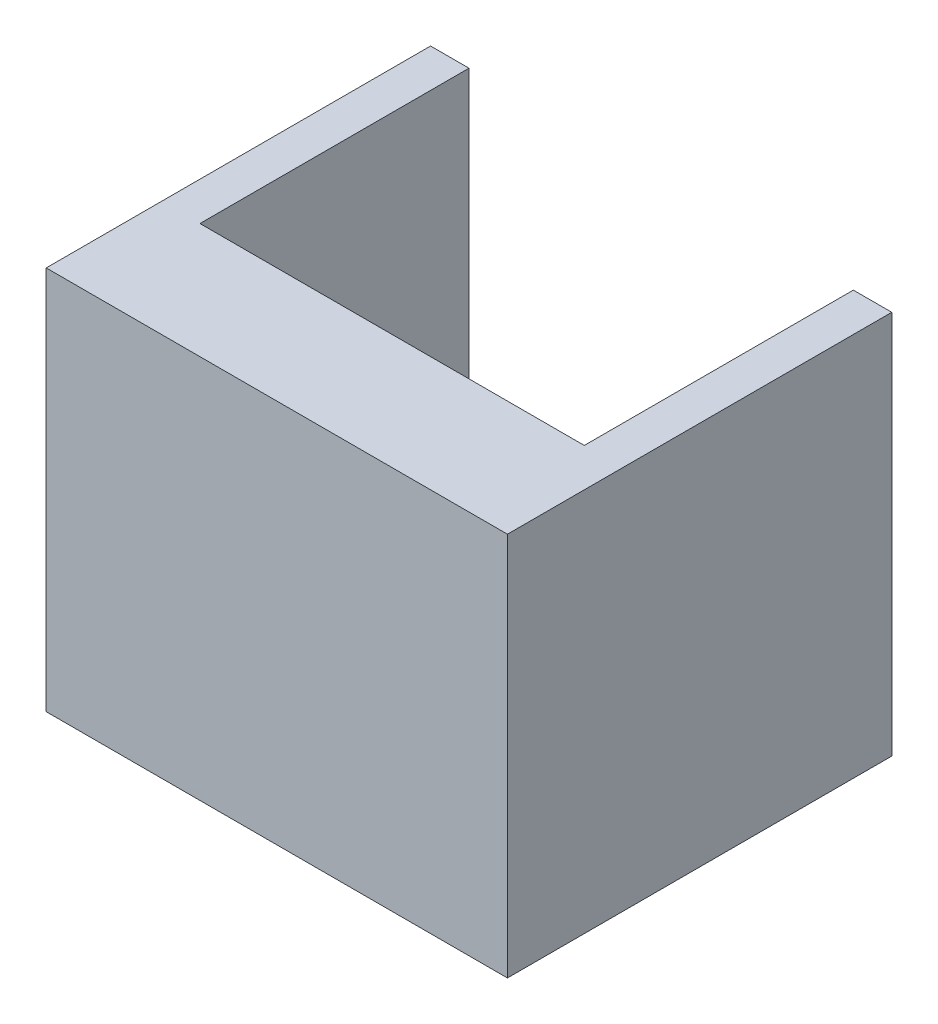
from build123d import *

# Parameters (mm, degrees)
BOSS_EXTRUDE1_DEPTH = 10


with BuildPart() as part:
    # Sketch1 → Boss-Extrude1 (new body)
    with BuildSketch(Plane(origin=(0, 0, 0), x_dir=(1, 0, 0), z_dir=(0, 1, 0))):
        Polygon((14.6, 5.111322526), (15.6, 5.111322526), (15.6, -4.888677474), (3.6, -4.888677474), (3.6, 5.111322526), (4.6, 5.111322526), (4.6, -1.888677474), (14.6, -1.888677474), align=None)
    extrude(amount=BOSS_EXTRUDE1_DEPTH)


solid = part.part
